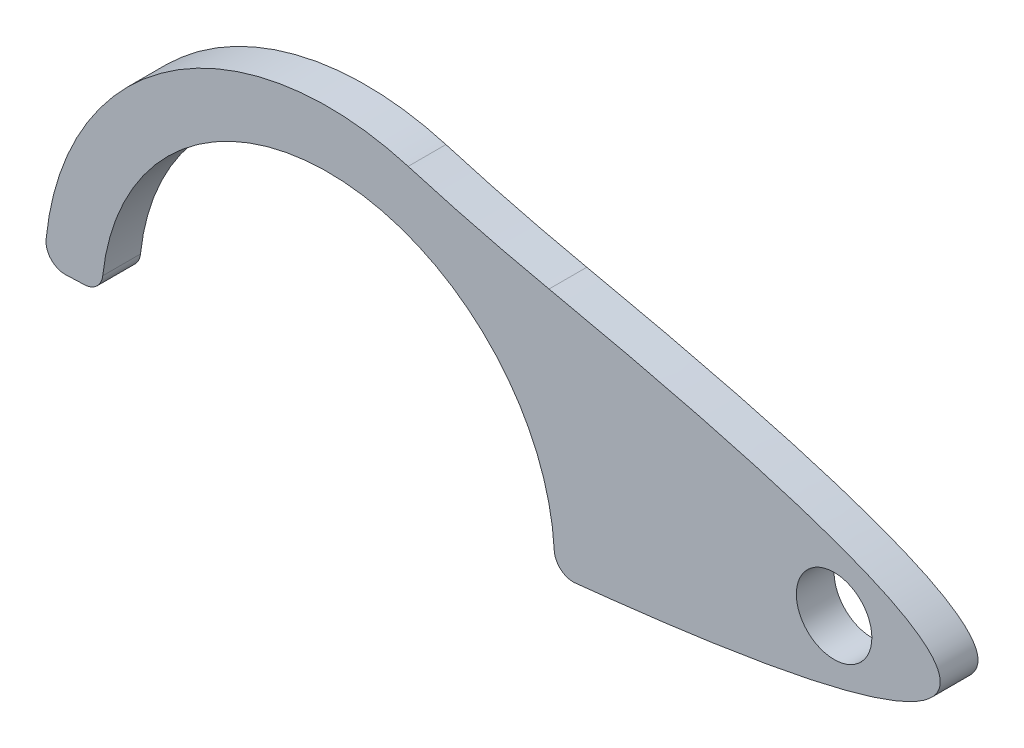
from build123d import *

# Parameters (mm, degrees)
ESQUISSE1_R        = 2
BOSS_EXTRU_1_DEPTH = 2
CONG_1_R           = 1
CONG_2_R           = 101


with BuildPart() as part:
    # Esquisse1 → Boss.-Extru.1 (new body)
    with BuildSketch(Plane.XY):
        with BuildLine():
            ThreePointArc((6.353742359, 13.587860686), (-7.923021794, 12.736786316), (-14.996867452, 0.306539744))
            Line((-14.996867452, 0.306539744), (-11.992657898, 0.419710068))
            ThreePointArc((-11.992657898, 0.419710068), (0.419710068, 11.992657898), (11.992657898, -0.419710068))
            Line((11.992657898, -0.419710068), (14.999728999, -0.090166274))
            add(Edge.make_bspline(
                [(6.353742359, 13.587860686), (53.739631024, 4.255841601), (14.999728999, -0.090166274)],
                knots=[0, 0, 0, 1, 1, 1], degree=2))
        make_face()
        with Locations((26.803607687, 5.048670414)):
            Circle(ESQUISSE1_R, mode=Mode.SUBTRACT)
    extrude(amount=BOSS_EXTRU_1_DEPTH)

    # Congé1
    cong_1_edges = [part.edges().sort_by_distance(p)[0] for p in [
        (11.992657898, -0.419710068, 1),
        (-11.992657898, 0.419710068, 1),
        (-14.996867452, 0.306539744, 1),
    ]]
    fillet(cong_1_edges, radius=CONG_1_R)

    # Congé2
    cong_2_edges = [part.edges().sort_by_distance(p)[0] for p in [
        (6.353742359, 13.587860686, 1),
    ]]
    fillet(cong_2_edges, radius=CONG_2_R)


solid = part.part
